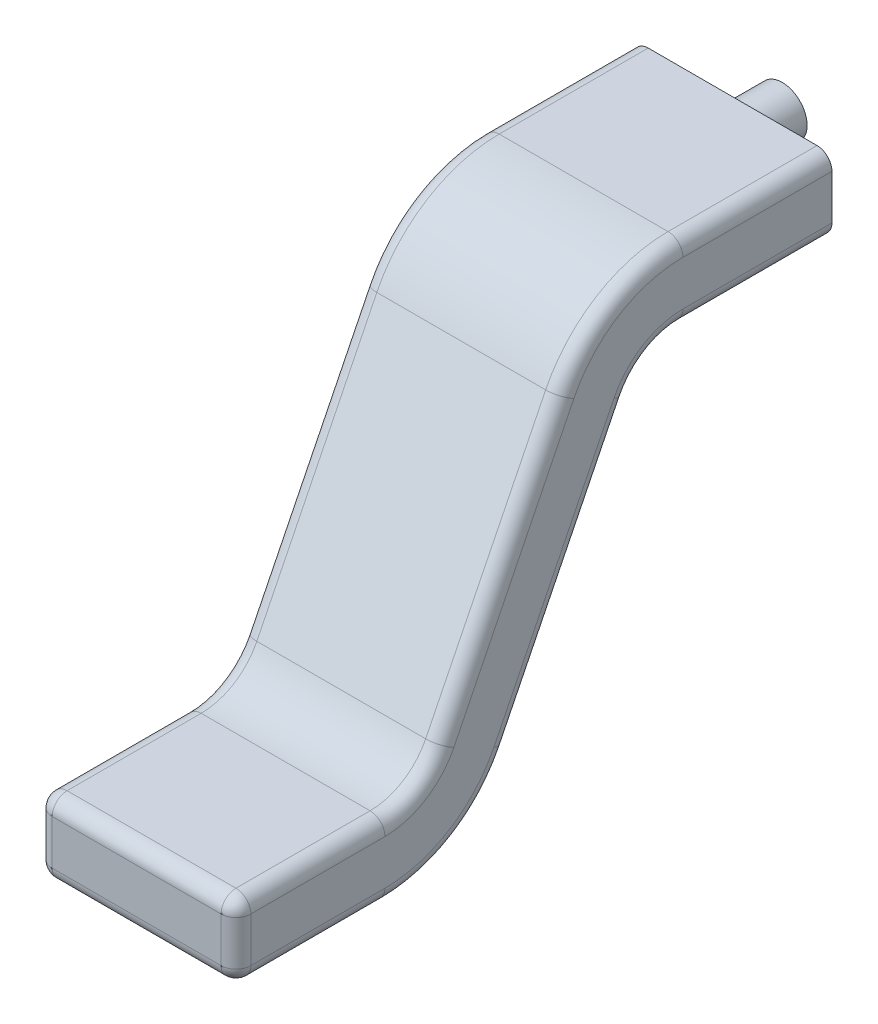
from build123d import *

# Parameters (mm, degrees)
FILETE2_R                = 0.03
ESBO_O3_R                = 0.05
RESSALTO_EXTRUS_O1_DEPTH = 0.1


with BuildPart() as part:
    # Varredura1: sweep along a path in Esboço2
    with BuildLine(Plane(origin=(0, 0, 0), x_dir=(0, 0, -1), z_dir=(1, 0, 0))) as varredura1_path:
        Line((0, 0), (0.3, 0))
        ThreePointArc((0.3, 0), (0.405455147, 0.030061152), (0.479209262, 0.11120788))
        Line((0.479209262, 0.11120788), (0.720790738, 0.59879212))
        ThreePointArc((0.720790738, 0.59879212), (0.794544853, 0.679938848), (0.9, 0.71))
        Line((0.9, 0.71), (1.2, 0.71))
    # Esboço1 → Varredura1 (sweep)
    with BuildSketch(Plane.XY):
        with BuildLine():
            Line((-0.17, -0.075), (0.17, -0.075))
            ThreePointArc((0.17, -0.075), (0.191213203, -0.066213203), (0.2, -0.045))
            Line((0.2, -0.045), (0.2, 0.045))
            ThreePointArc((0.2, 0.045), (0.191213203, 0.066213203), (0.17, 0.075))
            Line((0.17, 0.075), (-0.17, 0.075))
            ThreePointArc((-0.17, 0.075), (-0.191213203, 0.066213203), (-0.2, 0.045))
            Line((-0.2, 0.045), (-0.2, -0.045))
            ThreePointArc((-0.2, -0.045), (-0.191213203, -0.066213203), (-0.17, -0.075))
        make_face()
    sweep(path=varredura1_path.line)

    # Filete2
    filete2_edges = [part.edges().sort_by_distance(p)[0] for p in [
        (-0.2, 0, 0),
        (-0.191213203, 0.066213203, 0),
        (0, 0.075, 0),
        (0.191213203, 0.066213203, 0),
        (0.2, 0, 0),
        (0.191213203, -0.066213203, 0),
        (0, -0.075, 0),
        (-0.191213203, -0.066213203, 0),
    ]]
    fillet(filete2_edges, radius=FILETE2_R)

    # Esboço3 → Ressalto-extrusão1 (add)
    with BuildSketch(Plane(origin=(0, 0, -1.2), x_dir=(-1, 0, 0), z_dir=(0, 0, -1))):
        with Locations(Location((0, 0.71, 0), (0, 0, 270))):
            Circle(ESBO_O3_R)
    extrude(amount=RESSALTO_EXTRUS_O1_DEPTH)


solid = part.part
